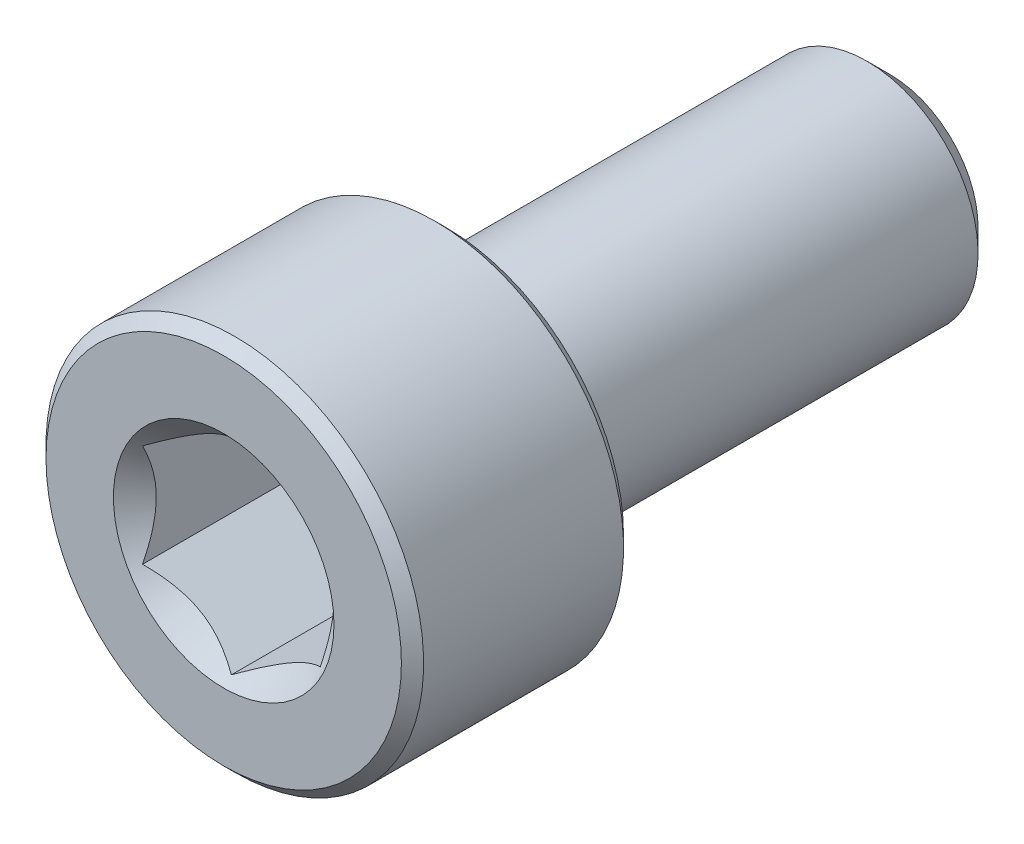
from build123d import *

# Parameters (mm, degrees)
CUT_EXTRUDE1_DEPTH = 4


with BuildPart() as part:
    # Sketch2 → Revolve1 (revolve)
    with BuildSketch(Plane(origin=(0, 0, 0), x_dir=(0, 0, -1), z_dir=(1, 0, 0))):
        with BuildLine():
            Line((-7.5, 0), (-7.5, 4))
            Line((-7.5, 4), (-7.25, 4.25))
            Line((-7.25, 4.25), (-2.75, 4.25))
            Line((-2.75, 4.25), (-2.5, 4))
            Line((-2.5, 4), (-2.5, 2.75))
            ThreePointArc((-2.5, 2.75), (-2.426776695, 2.573223305), (-2.25, 2.5))
            Line((-2.25, 2.5), (6.980384758, 2.5))
            Line((6.980384758, 2.5), (7.5, 1.980384758))
            Line((7.5, 1.980384758), (7.5, 0))
            Line((7.5, 0), (-7.5, 0))
        make_face()
    revolve(axis=Axis((0, 0, -7.5), (0, 0, 1)))

    # Sketch3 → Cut-Extrude1 (cut)
    with BuildSketch(Plane.XY.offset(7.5)):
        Polygon((2, -1.154700538), (2, 1.154700538), (0, 2.309401077), (-2, 1.154700538), (-2, -1.154700538), (0, -2.309401077), align=None)
    extrude(amount=-CUT_EXTRUDE1_DEPTH, mode=Mode.SUBTRACT)

    # Cut-Extrude2 cone 1 section (through the dimple's axis) → Cut-Extrude2 (revolve, cut)
    with BuildSketch(Plane(origin=(0, 0, 7.5), x_dir=(0, -1, 0), z_dir=(1, 0, 0))):
        Polygon((0, 0), (2.482606158, 0), (0, 2.482606158), align=None)
    revolve(axis=Axis((0, 0, 7.5), (0, 0, -1)), mode=Mode.SUBTRACT)


solid = part.part
